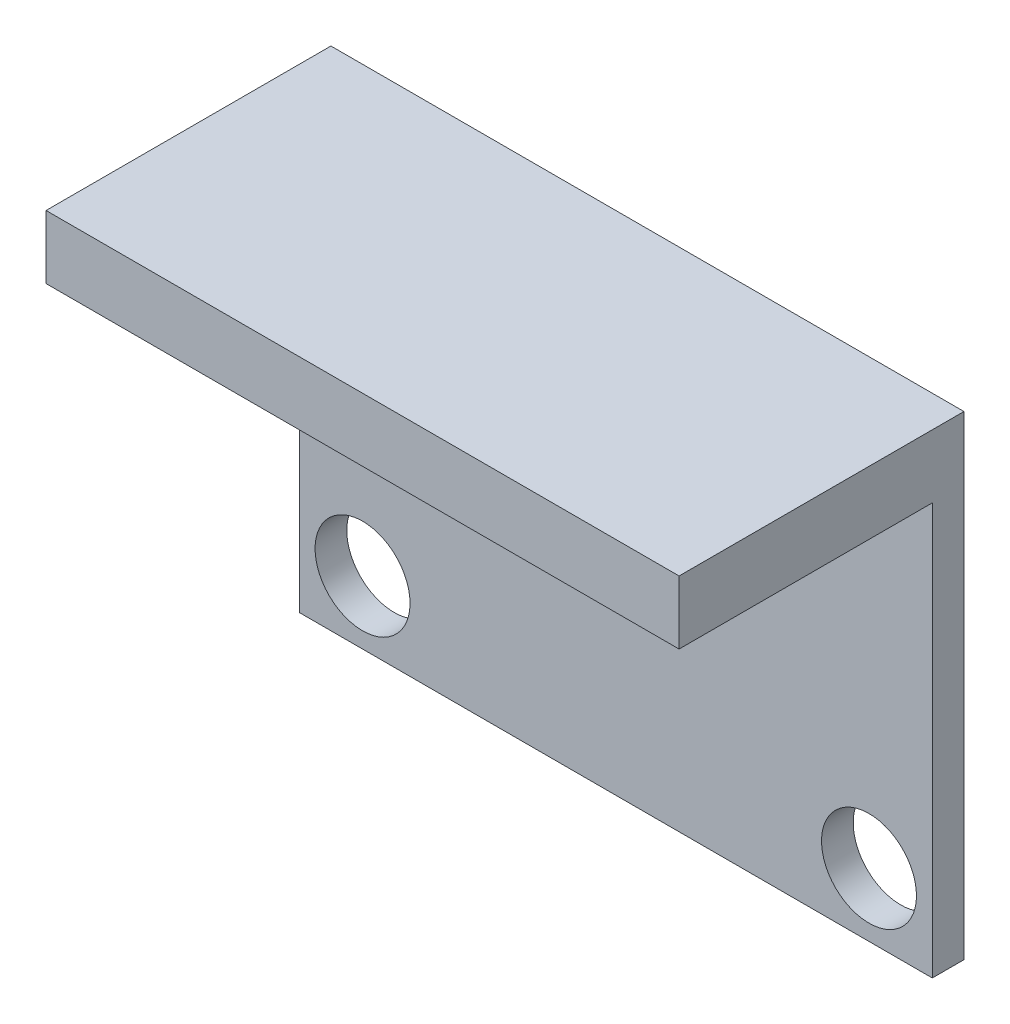
from build123d import *

# Parameters (mm, degrees)
ESBO_O1_W                = 20
ESBO_O1_H                = 15
ESBO_O1_R                = 1.5
RESSALTO_EXTRUS_O1_DEPTH = 0.5
ESBO_O2_W                = 20
ESBO_O2_H                = 2
RESSALTO_EXTRUS_O2_DEPTH = 8
CORTE_EXTRUS_O1_DEPTH    = 0.5


with BuildPart() as part:
    # Esboço1 → Ressalto-extrusão1 (new, symmetric)
    with BuildSketch(Plane.XY):
        Rectangle(ESBO_O1_W, ESBO_O1_H)
        with Locations((-8, -5.5)):
            Circle(ESBO_O1_R, mode=Mode.SUBTRACT)
        with Locations((8, -5.5)):
            Circle(ESBO_O1_R, mode=Mode.SUBTRACT)
    extrude(amount=RESSALTO_EXTRUS_O1_DEPTH, both=True)

    # Esboço2 → Ressalto-extrusão2 (add)
    with BuildSketch(Plane.XY.offset(0.5)):
        with Locations((0, 6.5)):
            Rectangle(ESBO_O2_W, ESBO_O2_H)
    extrude(amount=RESSALTO_EXTRUS_O2_DEPTH)

    # Esboço3 → Corte-extrusão1 (cut)
    # profile 1 of 6: a face of its own
    with BuildSketch(Plane(origin=(0, 0, -0.5), x_dir=(-1, 0, 0), z_dir=(0, 0, -1))):
        Polygon((-7.583333333, 3.5), (-5.878205128, 3.5), (-5.878205128, 3.141025641), (-7.269230769, 3.141025641), (-7.269230769, 2.064102564), (-5.878205128, 2.064102564), (-5.878205128, 1.705128205), (-7.269230769, 1.705128205), (-7.269230769, 0), (-7.583333333, 0), align=None)
    # profile 2 of 6: a face of its own
    with BuildSketch(Plane(origin=(0, 0, -0.5), x_dir=(-1, 0, 0), z_dir=(0, 0, -1))):
        with BuildLine():
            Line((-5.25, 3.5), (-4.549579327, 3.5))
            add(Edge.make_bspline(
                [(-4.549579327, 3.5), (-4.502838198, 3.499844414), (-4.413090054, 3.499545672), (-4.284516784, 3.497879909), (-4.167689687, 3.493105553), (-4.062669847, 3.48899697), (-3.969459192, 3.481505028), (-3.887771902, 3.474344381), (-3.817984204, 3.46497072), (-3.775738353, 3.456265297), (-3.756610577, 3.452323718)],
                knots=[0, 0, 0, 0, 1.410062039, 2.707475311, 3.878576406, 4.937260626, 5.877586885, 6.699081471, 7.410979367, 8, 8, 8, 8], degree=3))
            add(Edge.make_bspline(
                [(-3.756610577, 3.452323718), (-3.731003953, 3.445996953), (-3.680336963, 3.433478389), (-3.607386897, 3.407018788), (-3.537872573, 3.376399163), (-3.472082749, 3.340435443), (-3.410346958, 3.298860663), (-3.352028647, 3.252392541), (-3.296863184, 3.201285335), (-3.247081553, 3.144250494), (-3.200142502, 3.084413984), (-3.160553875, 3.019710227), (-3.126427396, 2.9520487), (-3.099256879, 2.880741282), (-3.077378905, 2.80647951), (-3.061952666, 2.728590713), (-3.052701478, 2.647429738), (-3.051759623, 2.59207183), (-3.051282051, 2.564002404)],
                knots=[0, 0, 0, 0, 1.027469482, 2.033020251, 3.019912614, 3.986113645, 4.951240523, 5.91722682, 6.890402269, 7.87763091, 8.8651537, 9.85103654, 10.82876324, 11.815024772, 12.821070561, 13.842952187, 14.906261191, 16, 16, 16, 16], degree=3))
            add(Edge.make_bspline(
                [(-3.051282051, 2.564002404), (-3.052751049, 2.517367299), (-3.055617445, 2.426370131), (-3.082342549, 2.29430925), (-3.126119069, 2.171119935), (-3.186442358, 2.056957297), (-3.263261833, 1.954046652), (-3.355586624, 1.863656197), (-3.463468236, 1.788016284), (-3.563897552, 1.735563479), (-3.652611752, 1.701970571), (-3.725645064, 1.678334212), (-3.805312042, 1.660072247), (-3.890849376, 1.643712115), (-3.982613032, 1.63136042), (-4.080383071, 1.622313826), (-4.184229223, 1.616659777), (-4.255568292, 1.615817772), (-4.292267628, 1.615384615)],
                knots=[0, 0, 0, 0, 1.260483769, 2.459530307, 3.627416485, 4.787058657, 5.939039949, 7.08810263, 8.267026773, 9.491475466, 10.141966685, 10.831826277, 11.566392101, 12.351337768, 13.187381173, 14.07005841, 15.007169909, 16, 16, 16, 16], degree=3))
            Line((-4.292267628, 1.615384615), (-3.006410256, 0))
            Line((-3.006410256, 0), (-3.394831731, 0))
            Line((-3.394831731, 0), (-4.680689103, 1.615384615))
            Line((-4.680689103, 1.615384615), (-4.935897436, 1.615384615))
            Line((-4.935897436, 1.615384615), (-4.935897436, 0))
            Line((-4.935897436, 0), (-5.25, 0))
            Line((-5.25, 0), (-5.25, 3.5))
        make_face()
        with BuildLine():
            Line((-4.935897436, 3.141025641), (-4.935897436, 1.974358974))
            Line((-4.935897436, 1.974358974), (-4.295072115, 1.969451122))
            add(Edge.make_bspline(
                [(-4.295072115, 1.969451122), (-4.265152076, 1.969437885), (-4.207158519, 1.969412229), (-4.123257855, 1.973406005), (-4.045137743, 1.977949323), (-3.973096991, 1.984898669), (-3.907103415, 1.99385474), (-3.847190002, 2.005057725), (-3.79325895, 2.018109787), (-3.730360412, 2.038311413), (-3.66012388, 2.070317431), (-3.583792421, 2.11688293), (-3.518790083, 2.175452049), (-3.463872221, 2.242425505), (-3.419742789, 2.316061754), (-3.388630735, 2.395478123), (-3.368888292, 2.478669721), (-3.366559747, 2.535847829), (-3.365384615, 2.564703526)],
                knots=[0, 0, 0, 0, 1.146690395, 2.22261258, 3.21895312, 4.145990853, 4.996080663, 5.770904154, 6.481378293, 7.121626537, 8.300444488, 9.431385265, 10.535395872, 11.636531494, 12.74115979, 13.810798291, 14.895190096, 16, 16, 16, 16], degree=3))
            add(Edge.make_bspline(
                [(-3.365384615, 2.564703526), (-3.366586736, 2.592850099), (-3.368968902, 2.648626338), (-3.38841767, 2.730282248), (-3.421307052, 2.807349198), (-3.46562929, 2.879513683), (-3.519628445, 2.945019419), (-3.582946257, 3.001066572), (-3.653851452, 3.047316037), (-3.720122651, 3.076870418), (-3.779356863, 3.094990271), (-3.830786523, 3.107741435), (-3.888898001, 3.117985904), (-3.95397346, 3.126193964), (-4.02573509, 3.133248909), (-4.104545742, 3.138000687), (-4.189882522, 3.140814551), (-4.249029453, 3.14095364), (-4.279647436, 3.141025641)],
                knots=[0, 0, 0, 0, 1.101028733, 2.181837193, 3.264309656, 4.369019818, 5.486613113, 6.575447106, 7.666700264, 8.788928104, 9.402425223, 10.0903467, 10.862060571, 11.710948788, 12.657782767, 13.684531032, 14.801375019, 16, 16, 16, 16], degree=3))
            Line((-4.279647436, 3.141025641), (-4.935897436, 3.141025641))
        make_face(mode=Mode.SUBTRACT)
    # profile 3 of 6: a face of its own
    with BuildSketch(Plane(origin=(0, 0, -0.5), x_dir=(-1, 0, 0), z_dir=(0, 0, -1))):
        Polygon((-2.288461538, 3.5), (-0.314102564, 3.5), (-0.314102564, 3.141025641), (-1.974358974, 3.141025641), (-1.974358974, 2.064102564), (-0.314102564, 2.064102564), (-0.314102564, 1.705128205), (-1.974358974, 1.705128205), (-1.974358974, 0.358974359), (-0.314102564, 0.358974359), (-0.314102564, 0), (-2.288461538, 0), align=None)
    # profile 4 of 6: a face of its own
    with BuildSketch(Plane(origin=(0, 0, -0.5), x_dir=(-1, 0, 0), z_dir=(0, 0, -1))):
        Polygon((0.314102564, 0), (0.314102564, 3.5), (0.380008013, 3.5), (2.692307692, 0.745292468), (2.692307692, 3.5), (3.006410256, 3.5), (3.006410256, 0), (2.934895833, 0), (0.628205128, 2.748397436), (0.628205128, 0), align=None)
    # profile 5 of 6: a face of its own
    with BuildSketch(Plane(origin=(0, 0, -0.5), x_dir=(-1, 0, 0), z_dir=(0, 0, -1))):
        Polygon((3.5, 3.141025641), (3.5, 3.5), (5.33974359, 3.5), (5.33974359, 3.141025641), (4.576923077, 3.141025641), (4.576923077, 0), (4.262820513, 0), (4.262820513, 3.141025641), align=None)
    # profile 6 of 6: a face of its own
    with BuildSketch(Plane(origin=(0, 0, -0.5), x_dir=(-1, 0, 0), z_dir=(0, 0, -1))):
        Polygon((5.878205128, 3.5), (7.852564103, 3.5), (7.852564103, 3.141025641), (6.192307692, 3.141025641), (6.192307692, 2.064102564), (7.852564103, 2.064102564), (7.852564103, 1.705128205), (6.192307692, 1.705128205), (6.192307692, 0.358974359), (7.852564103, 0.358974359), (7.852564103, 0), (5.878205128, 0), align=None)
    extrude(amount=-CORTE_EXTRUS_O1_DEPTH, mode=Mode.SUBTRACT)


solid = part.part
